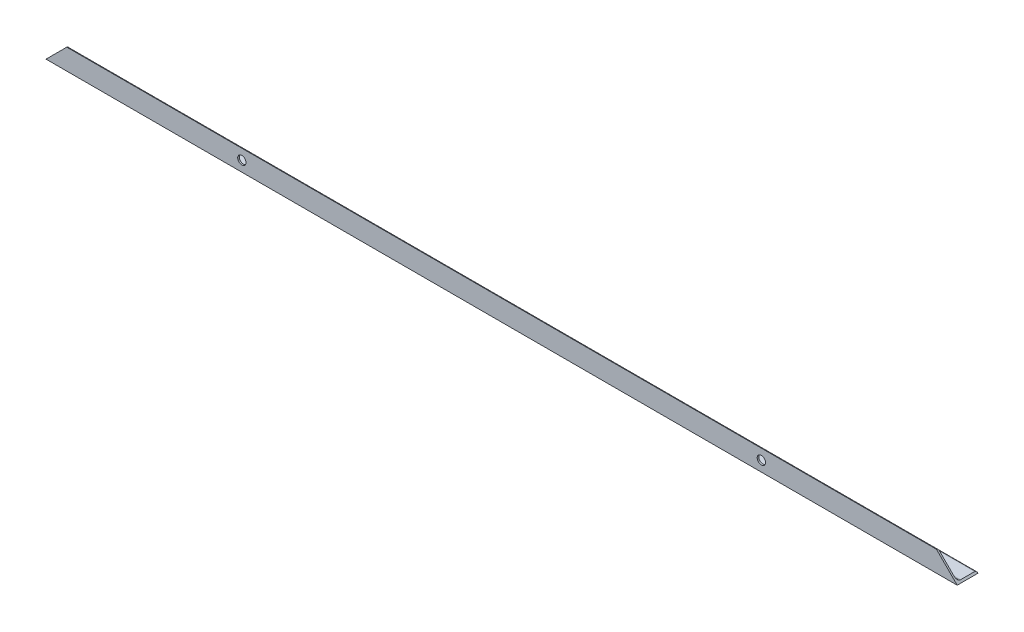
from build123d import *

# Parameters (mm, degrees)
L_ANGLE_EQUAL_40X40X3_6_DEPTH = 1754
SKETCH14_R                    = 8
CUT_EXTRUDE1_DEPTH            = 1755.911963604


with BuildPart() as part:
    # Sketch13 → L angle (equal) 40X40X3(6) (new body)
    with BuildSketch(Plane(origin=(0, 0, 0), x_dir=(0, 0, -1), z_dir=(1, 0, 0))):
        with BuildLine():
            Line((0, 40), (0, 0))
            Line((0, 0), (40, 0))
            ThreePointArc((40, 0), (39.121320344, 2.121320344), (37, 3))
            Line((37, 3), (9, 3))
            ThreePointArc((9, 3), (4.757359313, 4.757359313), (3, 9))
            Line((3, 9), (3, 37))
            ThreePointArc((3, 37), (2.121320344, 39.121320344), (0, 40))
        make_face()
    extrude(amount=L_ANGLE_EQUAL_40X40X3_6_DEPTH)

    # Sketch14 → Cut-Extrude1 (cut, through all)
    with BuildSketch(Plane.XY):
        with Locations((377, 20)):
            Circle(SKETCH14_R)
        with Locations((1377, 20)):
            Circle(SKETCH14_R)
        Polygon((1754, 0), (1754, 40), (1714, 40), align=None)
        Polygon((0, 40), (0, 0), (40, 40), align=None)
    extrude(amount=-CUT_EXTRUDE1_DEPTH, mode=Mode.SUBTRACT)


solid = part.part
